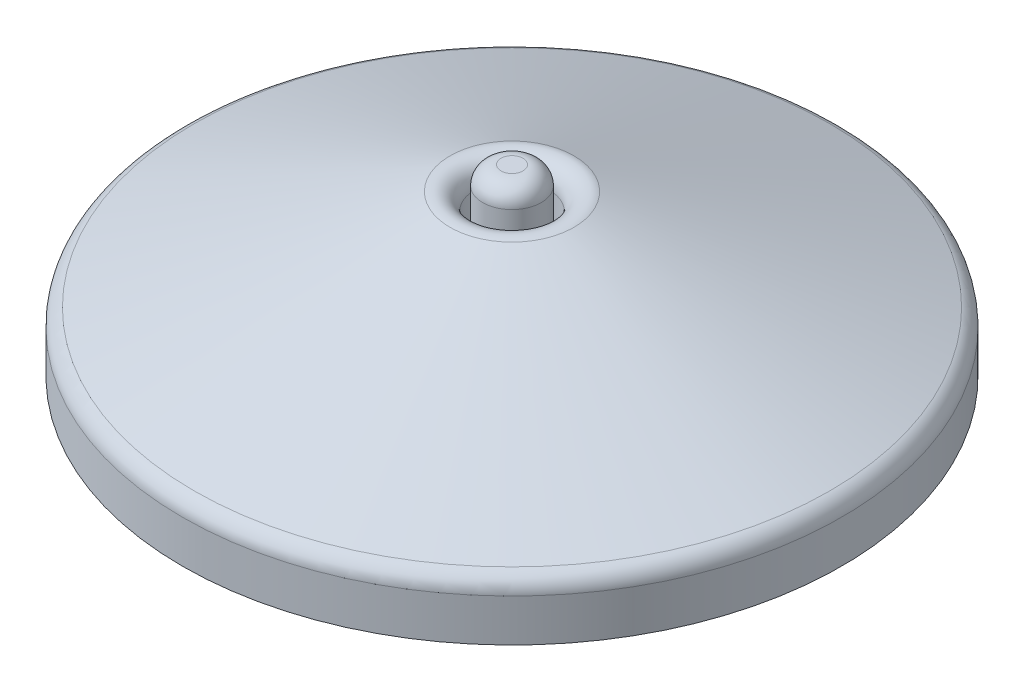
from build123d import *


with BuildPart() as part:
    # 草图3 → 旋转1 (revolve)
    with BuildSketch(Plane.XY, mode=Mode.PRIVATE) as revolve_1_sk:
        with BuildLine():
            Line((90, -15), (90, -3.411628169))
            ThreePointArc((90, -3.411628169), (89.130160961, -0.593513474), (86.823291826, 1.24407875))
            Line((86.823291826, 1.24407875), (16.923291826, 28.61867531))
            ThreePointArc((16.923291826, 28.61867531), (12.281885305, 28.093129351), (10.1, 23.96296839))
            Line((10.1, 23.96296839), (10.1, 0))
            Line((10.1, 0), (8, 0))
            Line((8, 0), (8, 30))
            ThreePointArc((8, 30), (6.535533906, 33.535533906), (3, 35))
            Line((3, 35), (0, 35))
            Line((0, 35), (0, 0))
            Line((0, 0), (0, -15))
            Line((0, -15), (90, -15))
        make_face()
    revolve(revolve_1_sk.sketch.rotate(Axis((0, 0, 0), (0, 1, 0)), 90), axis=Axis((0, 0, 0), (0, 1, 0)))


solid = part.part
